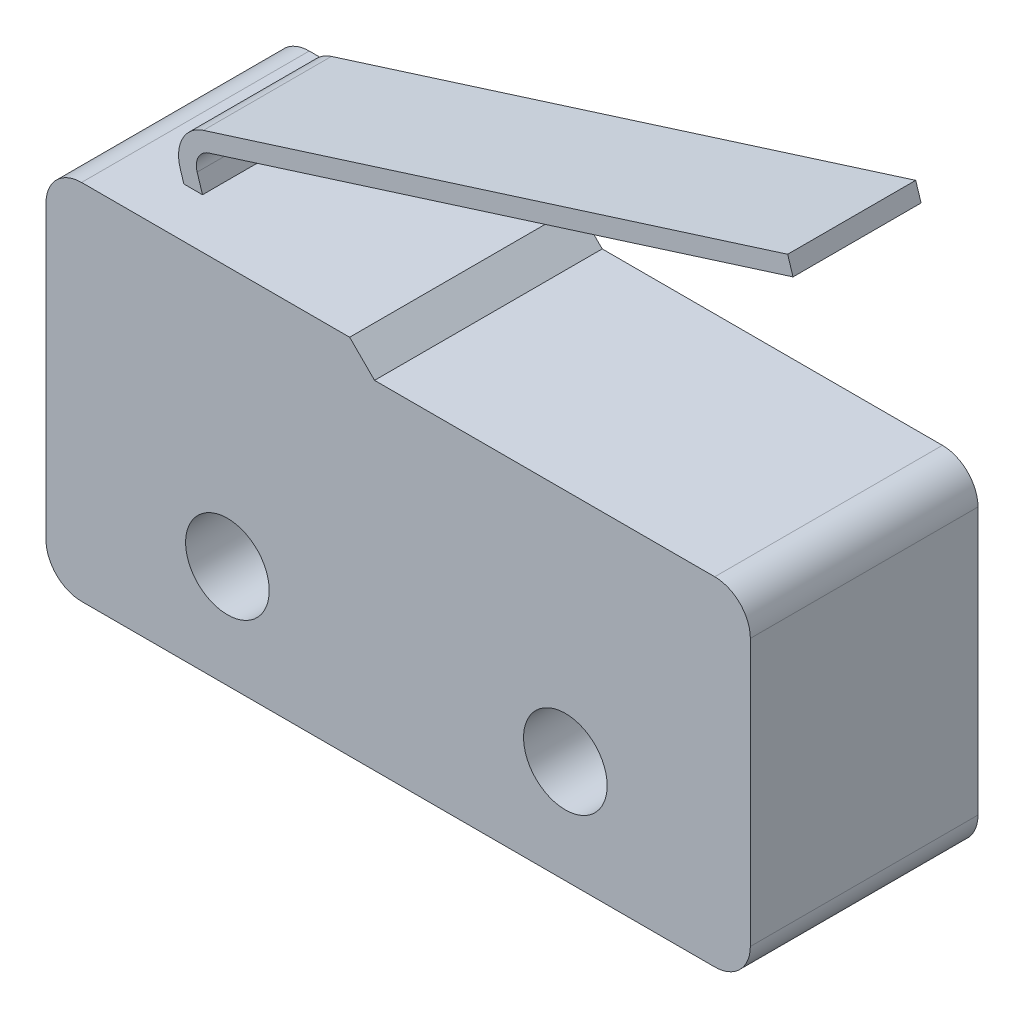
from build123d import *

# Parameters (mm, degrees)
ESQUISSE1_R        = 1.175
BOSS_EXTRU_1_DEPTH = 6.4
BOSS_EXTRU_2_DEPTH = 3.6


with BuildPart() as part:
    # Esquisse1 → Boss.-Extru.1 (new body)
    with BuildSketch(Plane.XY):
        with BuildLine():
            Line((1, 0), (18.8, 0))
            ThreePointArc((18.8, 0), (19.507106781, 0.292893219), (19.8, 1))
            Line((19.8, 1), (19.8, 8.5))
            ThreePointArc((19.8, 8.5), (19.507106781, 9.207106781), (18.8, 9.5))
            Line((18.8, 9.5), (9.235956187, 9.5))
            Line((9.235956187, 9.5), (8.535956187, 10.2))
            Line((8.535956187, 10.2), (1, 10.2))
            ThreePointArc((1, 10.2), (0.292893219, 9.907106781), (0, 9.2))
            Line((0, 9.2), (0, 1))
            ThreePointArc((0, 1), (0.292893219, 0.292893219), (1, 0))
        make_face()
        with Locations((5.1, 2.9)):
            Circle(ESQUISSE1_R, mode=Mode.SUBTRACT)
        with Locations((14.6, 2.9)):
            Circle(ESQUISSE1_R, mode=Mode.SUBTRACT)
    extrude(amount=BOSS_EXTRU_1_DEPTH)

    # Esquisse2 → Boss.-Extru.2 (add)
    with BuildSketch(Plane.XY.offset(5)):
        with BuildLine():
            Line((2.475579427, 10.2), (2.372481297, 10.525914526))
            ThreePointArc((2.372481297, 10.525914526), (2.438469066, 11.288431445), (3.024310349, 11.780951931))
            Line((3.024310349, 11.780951931), (19.449197912, 16.976716614))
            Line((19.449197912, 16.976716614), (19.6, 16.5))
            Line((19.6, 16.5), (3.175112437, 11.304235317))
            ThreePointArc((3.175112437, 11.304235317), (2.882191796, 11.057975074), (2.849197912, 10.676716614))
            Line((2.849197912, 10.676716614), (3, 10.2))
            Line((3, 10.2), (2.475579427, 10.2))
        make_face()
    extrude(amount=-BOSS_EXTRU_2_DEPTH)


solid = part.part
